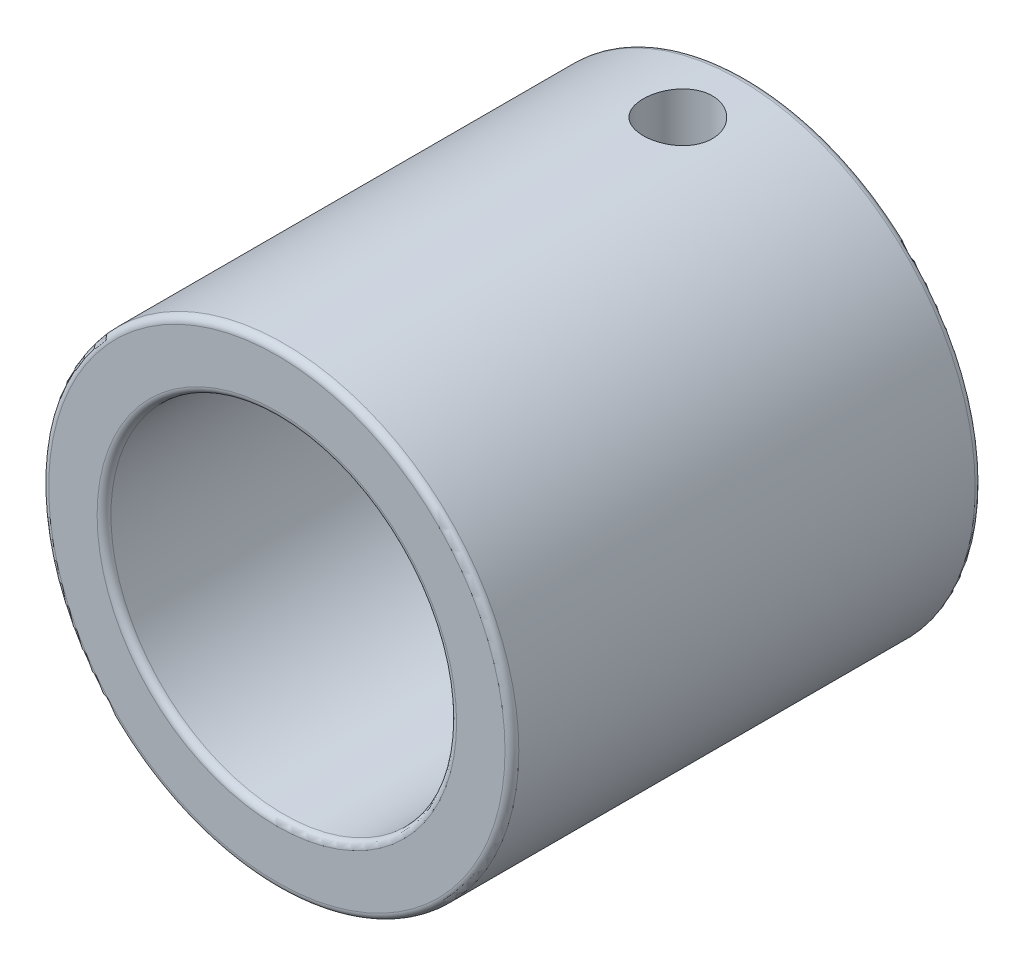
from build123d import *

# Parameters (mm, degrees)
IZIM1_R                     = 17
IZIM1_R_2                   = 12.5
Y_KSEKLIK_EKSTR_ZYON1_DEPTH = 34
RADYUS1_R                   = 0.5
KES_EKSTR_ZYON1_DEPTH       = 42.641325709
KES_EKSTR_ZYON1_DEPTH_BACK  = 42.641325709
IZIM2_R                     = 2.5


with BuildPart() as part:
    # Çizim1 → Yükseklik-Ekstrüzyon1 (new body)
    with BuildSketch(Plane.XY):
        Circle(IZIM1_R)
        Circle(IZIM1_R_2, mode=Mode.SUBTRACT)
    extrude(amount=Y_KSEKLIK_EKSTR_ZYON1_DEPTH)

    # Radyus1
    radyus1_edges = [part.edges().sort_by_distance(p)[0] for p in [
        (-17, 0, 0),
        (-17, 0, 34),
        (-12.5, 0, 0),
        (-12.5, 0, 34),
    ]]
    fillet(radyus1_edges, radius=RADYUS1_R)

    # Çizim2 → Kes-Ekstrüzyon1 (cut, two sides: drawn at the far end of the back side and taken through both)
    with BuildSketch(Plane(origin=(0, 0, 0), x_dir=(1, 0, 0), z_dir=(0, 1, 0)).offset(-KES_EKSTR_ZYON1_DEPTH_BACK)):
        with Locations(Location((0, -5, 0), (0, 0, 270))):
            Circle(IZIM2_R)
    extrude(amount=KES_EKSTR_ZYON1_DEPTH + KES_EKSTR_ZYON1_DEPTH_BACK, mode=Mode.SUBTRACT)


solid = part.part
